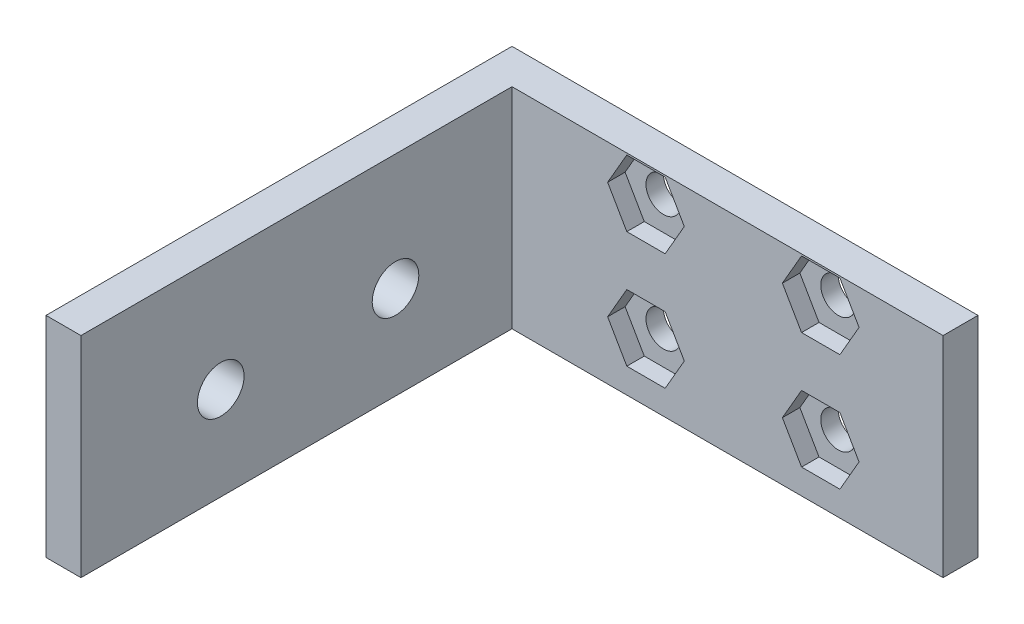
from build123d import *

# Parameters (mm, degrees)
ESQUISSE1_W             = 40
ESQUISSE1_H             = 18
BOSS_EXTRU_1_DEPTH      = 3
ESQUISSE2_W             = 3
ESQUISSE2_H             = 18
BOSS_EXTRU_2_DEPTH      = 37
ESQUISSE3_R             = 1.5
ENL_V_MAT_EXTRU_1_DEPTH = 58.384666942
ESQUISSE4_R             = 2
ENL_V_MAT_EXTRU_2_DEPTH = 58.384666942
ENL_V_MAT_EXTRU_3_DEPTH = 1.5


with BuildPart() as part:
    # Esquisse1 → Boss.-Extru.1 (new body)
    with BuildSketch(Plane.XY):
        with Locations((20, 9)):
            Rectangle(ESQUISSE1_W, ESQUISSE1_H)
    extrude(amount=BOSS_EXTRU_1_DEPTH)

    # Esquisse2 → Boss.-Extru.2 (add)
    with BuildSketch(Plane.XY.offset(3)):
        with Locations((1.5, 9)):
            Rectangle(ESQUISSE2_W, ESQUISSE2_H)
    extrude(amount=BOSS_EXTRU_2_DEPTH)

    # Esquisse3 → Enlèv. mat.-Extru.1 (cut, through all)
    with BuildSketch(Plane.XY.offset(3)):
        with Locations((14.5, 15)):
            Circle(ESQUISSE3_R)
        with Locations((29.5, 15)):
            Circle(ESQUISSE3_R)
        with Locations((14.5, 5)):
            Circle(ESQUISSE3_R)
        with Locations((29.5, 5)):
            Circle(ESQUISSE3_R)
    extrude(amount=-ENL_V_MAT_EXTRU_1_DEPTH, mode=Mode.SUBTRACT)

    # Esquisse4 → Enlèv. mat.-Extru.2 (cut, through all)
    with BuildSketch(Plane(origin=(3, 0, 0), x_dir=(0, 0, -1), z_dir=(1, 0, 0))):
        with Locations(Location((-28, 8, 0), (0, 0, 90))):
            Circle(ESQUISSE4_R)
        with Locations(Location((-13, 8, 0), (0, 0, 90))):
            Circle(ESQUISSE4_R)
    extrude(amount=-ENL_V_MAT_EXTRU_2_DEPTH, mode=Mode.SUBTRACT)

    # Esquisse5 → Enlèv. mat.-Extru.3 (cut)
    with BuildSketch(Plane.XY.offset(3)):
        Polygon((12.854551733, 7.85), (11.209103466, 5), (12.854551733, 2.15), (16.145448267, 2.15), (17.790896534, 5), (16.145448267, 7.85), align=None)
        Polygon((27.854551733, 17.85), (26.209103466, 15), (27.854551733, 12.15), (31.145448267, 12.15), (32.790896534, 15), (31.145448267, 17.85), align=None)
        Polygon((27.854551733, 7.85), (26.209103466, 5), (27.854551733, 2.15), (31.145448267, 2.15), (32.790896534, 5), (31.145448267, 7.85), align=None)
        Polygon((12.854551733, 17.85), (11.209103466, 15), (12.854551733, 12.15), (16.145448267, 12.15), (17.790896534, 15), (16.145448267, 17.85), align=None)
    extrude(amount=-ENL_V_MAT_EXTRU_3_DEPTH, mode=Mode.SUBTRACT)


solid = part.part
